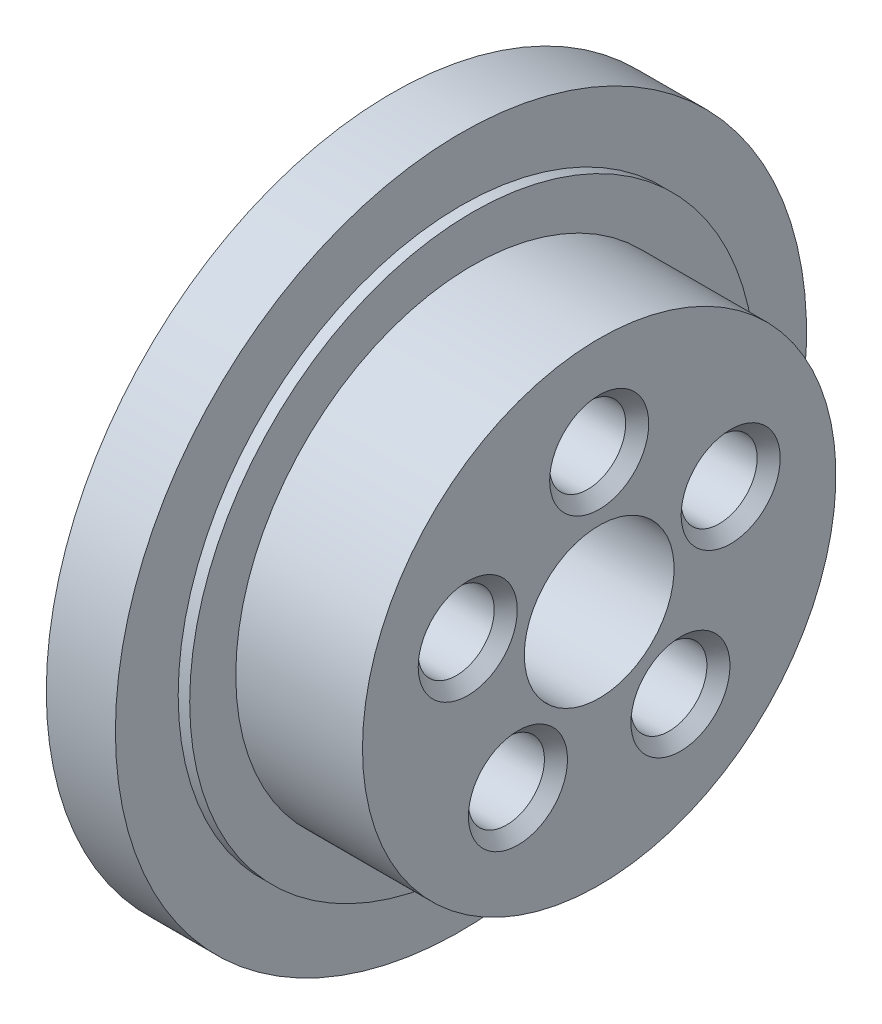
from build123d import *

# Parameters (mm, degrees)
SKETCH2_R          = 2.5
CUT_EXTRUDE1_DEPTH = 4.5
SKETCH3_R          = 3.3
CUT_EXTRUDE2_DEPTH = 10.5
CHAMFER1_SIZE      = 1


with BuildPart() as part:
    # Sketch1 → Revolve1 (revolve)
    with BuildSketch(Plane.XY, mode=Mode.PRIVATE) as revolve1_sk:
        Polygon((0, 30), (6, 30), (6, 24.55), (7, 24.55), (7, 20.55), (18, 20.55), (18, 6.5), (6, 6.5), (6, 7.5), (0, 7.5), align=None)
    revolve(revolve1_sk.sketch.rotate(Axis((0, 0, 0), (1, 0, 0)), 90), axis=Axis((0, 0, 0), (1, 0, 0)))

    # Sketch2 → Cut-Extrude1 (cut)
    with BuildSketch(Plane.ZY):
        with Locations((0, 20)):
            Circle(SKETCH2_R)
        with Locations((17.320508076, 10)):
            Circle(SKETCH2_R)
        with Locations((17.320508076, -10)):
            Circle(SKETCH2_R)
        with Locations((0, -20)):
            Circle(SKETCH2_R)
        with Locations((-17.320508076, -10)):
            Circle(SKETCH2_R)
        with Locations((-17.320508076, 10)):
            Circle(SKETCH2_R)
    extrude(amount=-CUT_EXTRUDE1_DEPTH, mode=Mode.SUBTRACT)

    # Sketch3 → Cut-Extrude2 (cut)
    with BuildSketch(Plane(origin=(18, 0, 0), x_dir=(0, 0, -1), z_dir=(1, 0, 0))):
        with Locations((0, 12)):
            Circle(SKETCH3_R)
        with Locations((11.412678196, 3.708203932)):
            Circle(SKETCH3_R)
        with Locations((7.053423028, -9.708203932)):
            Circle(SKETCH3_R)
        with Locations((-7.053423028, -9.708203932)):
            Circle(SKETCH3_R)
        with Locations((-11.412678196, 3.708203932)):
            Circle(SKETCH3_R)
    extrude(amount=-CUT_EXTRUDE2_DEPTH, mode=Mode.SUBTRACT)

    # Chamfer1
    chamfer1_edges = [part.edges().sort_by_distance(p)[0] for p in [
        (18, 12, 3.3),
        (18, 3.708203932, -8.112678196),
        (18, -9.708203932, -3.753423028),
        (18, -9.708203932, 10.353423028),
        (18, 3.708203932, 14.712678196),
    ]]
    chamfer(chamfer1_edges, length=CHAMFER1_SIZE)


solid = part.part
